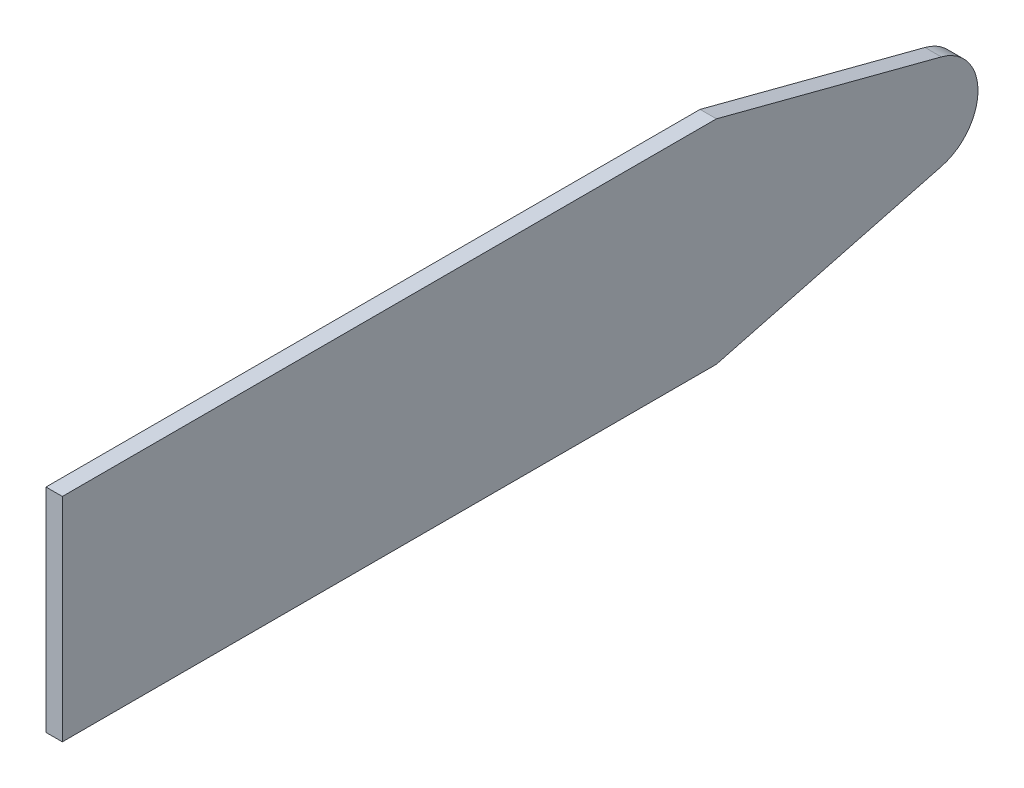
from build123d import *

# Parameters (mm, degrees)
EXTRUDE_1_DEPTH = 10


with BuildPart() as part:
    # 草图1 → 凸台-拉伸1 (new body)
    with BuildSketch(Plane(origin=(0, 0, 0), x_dir=(0, 0, -1), z_dir=(1, 0, 0))):
        with BuildLine():
            Line((7.589042449, 29.024238745), (-130, 65))
            Line((-130, 65), (-530, 65))
            Line((-530, 65), (-530, -65))
            Line((-530, -65), (-130, -65))
            Line((-130, -65), (7.589042449, -29.024238745))
            ThreePointArc((7.589042449, -29.024238745), (30, 0), (7.589042449, 29.024238745))
        make_face()
    extrude(amount=EXTRUDE_1_DEPTH)


solid = part.part
